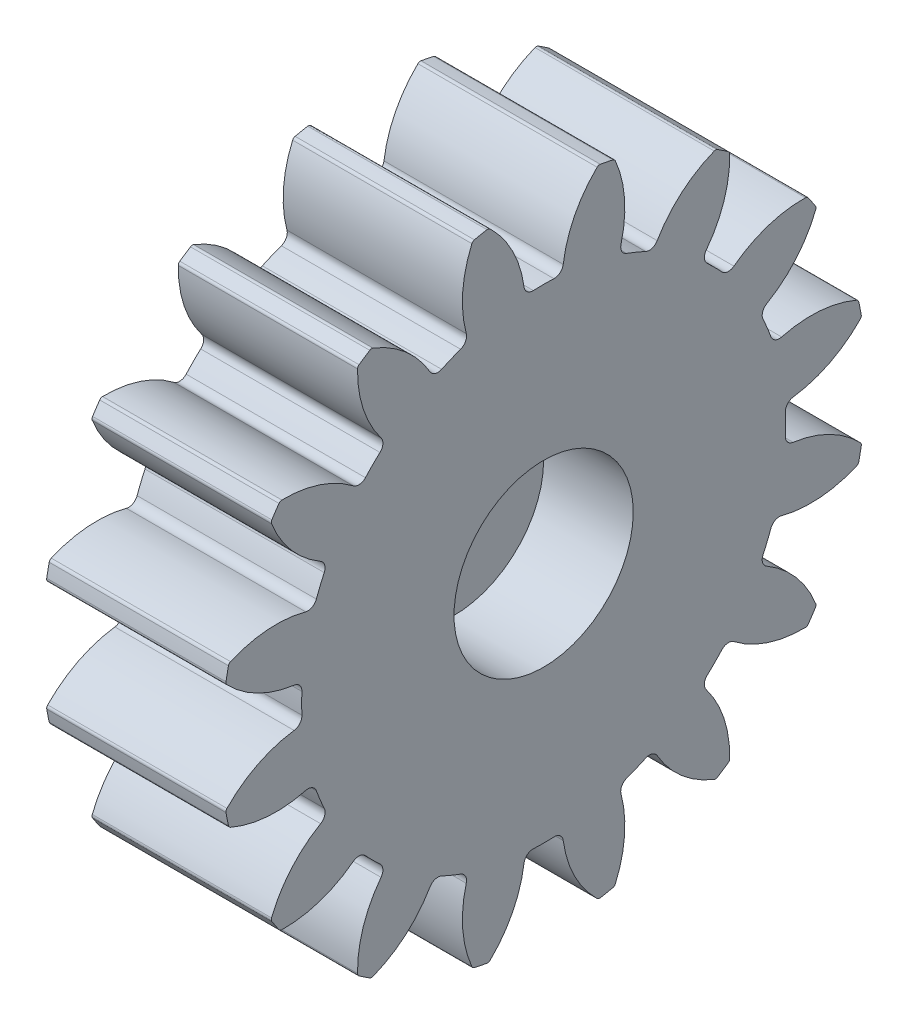
from build123d import *

# Parameters (mm, degrees)
BASPROSKE_W                = 5
BASPROSKE_H                = 9
TOOTHCUT_DEPTH             = 14.674794331
BREAKS_R                   = 0.1
ROOTFILLETS_R              = 0.251
TEETHCUTS_COUNT            = 16
TEETHCUTS_ANGLE            = 337.5
BREAKS_OF_TEETHCUTS_R      = 0.1
ROOTFILLETS_OF_TEETHCUTS_R = 0.251
BORSKE_R                   = 1
BORE_DEPTH                 = 50.0000508
SZKIC1_R                   = 2.5
WYTNIJ_WYCI_GNI_CIE1_DEPTH = 2.5
SZKIC2_R                   = 2
WYTNIJ_WYCI_GNI_CIE2_DEPTH = 1


with BuildPart() as part:
    # BasProSke → Base-Revolve (revolve)
    with BuildSketch(Plane(origin=(0, 0, 0), x_dir=(1, 0, 0), z_dir=(0, 1, 0)), mode=Mode.PRIVATE) as base_revolve_sk:
        with Locations((2.5, 4.5)):
            Rectangle(BASPROSKE_W, BASPROSKE_H)
    revolve(base_revolve_sk.sketch.rotate(Axis((-10, 0, 0), (1, 0, 0)), 180), axis=Axis((-10, 0, 0), (1, 0, 0)))

    # TooCutSke → ToothCut (cut, through all)
    with BuildSketch(Plane(origin=(0, 0, 0), x_dir=(0, 0, -1), z_dir=(1, 0, 0))):
        with BuildLine():
            ThreePointArc((0.523792937, 6.728643397), (0, 6.749), (-0.523792937, 6.728643397))
            ThreePointArc((-0.523792937, 6.728643397), (-0.828704482, 7.90962059), (-1.553355277, 8.890721711))
            ThreePointArc((-1.553355277, 8.890721711), (0, 9.0254), (1.553355277, 8.890721711))
            ThreePointArc((1.553355277, 8.890721711), (0.828704482, 7.90962059), (0.523792937, 6.728643397))
        make_face()
    toothcut = extrude(amount=TOOTHCUT_DEPTH, mode=Mode.SUBTRACT)

    # Breaks
    breaks_edges = [part.edges().sort_by_distance(p)[0] for p in [
        (2.5, 8.869006051, -1.529944991),
        (2.5, 8.869006051, 1.529944991),
    ]]
    fillet(breaks_edges, radius=BREAKS_R)

    # RootFillets
    rootfillets_edges = [part.edges().sort_by_distance(p)[0] for p in [
        (2.5, 6.728643397, -0.523792937),
        (2.5, 6.728643397, 0.523792937),
    ]]
    fillet(rootfillets_edges, radius=ROOTFILLETS_R)

    # TeethCuts: ToothCut ×16 about axis
    teethcuts_axis = Axis((-10, 0, 0), (1, 0, 0))
    for i in range(1, TEETHCUTS_COUNT):
        add(toothcut.rotate(teethcuts_axis, i * TEETHCUTS_ANGLE / (TEETHCUTS_COUNT - 1)), mode=Mode.SUBTRACT)

    # Breaks of TeethCuts
    breaks_of_teethcuts_edges = [part.edges().sort_by_distance(p)[0] for p in [
        (2.5, 8.779377764, 1.980536814),
        (2.5, 7.608408563, 4.80750654),
        (2.5, 7.353168799, 5.189499843),
        (2.5, 5.189499843, 7.353168799),
        (2.5, 4.80750654, 7.608408563),
        (2.5, 1.980536814, 8.779377764),
        (2.5, 1.529944991, 8.869006051),
        (2.5, -1.529944991, 8.869006051),
        (2.5, -1.980536814, 8.779377764),
        (2.5, -4.80750654, 7.608408563),
        (2.5, -5.189499843, 7.353168799),
        (2.5, -7.353168799, 5.189499843),
        (2.5, -7.608408563, 4.80750654),
        (2.5, -8.779377764, 1.980536814),
        (2.5, -8.869006051, 1.529944991),
        (2.5, -8.869006051, -1.529944991),
        (2.5, -8.779377764, -1.980536814),
        (2.5, -7.608408563, -4.80750654),
        (2.5, -7.353168799, -5.189499843),
        (2.5, -5.189499843, -7.353168799),
        (2.5, -4.80750654, -7.608408563),
        (2.5, -1.980536814, -8.779377764),
        (2.5, -1.529944991, -8.869006051),
        (2.5, 1.529944991, -8.869006051),
        (2.5, 1.980536814, -8.779377764),
        (2.5, 4.80750654, -7.608408563),
        (2.5, 5.189499843, -7.353168799),
        (2.5, 7.353168799, -5.189499843),
        (2.5, 7.608408563, -4.80750654),
        (2.5, 8.779377764, -1.980536814),
    ]]
    fillet(breaks_of_teethcuts_edges, radius=BREAKS_OF_TEETHCUTS_R)

    # RootFillets of TeethCuts
    rootfillets_of_teethcuts_edges = [part.edges().sort_by_distance(p)[0] for p in [
        (2.5, 6.416902795, 2.091018776),
        (2.5, 6.016009037, 3.058861924),
        (2.5, 5.128246912, 4.387491836),
        (2.5, 4.387491836, 5.128246912),
        (2.5, 3.058861924, 6.016009037),
        (2.5, 2.091018776, 6.416902795),
        (2.5, 0.523792937, 6.728643397),
        (2.5, -0.523792937, 6.728643397),
        (2.5, -2.091018776, 6.416902795),
        (2.5, -3.058861924, 6.016009037),
        (2.5, -4.387491836, 5.128246912),
        (2.5, -5.128246912, 4.387491836),
        (2.5, -6.016009037, 3.058861924),
        (2.5, -6.416902795, 2.091018776),
        (2.5, -6.728643397, 0.523792937),
        (2.5, -6.728643397, -0.523792937),
        (2.5, -6.416902795, -2.091018776),
        (2.5, -6.016009037, -3.058861924),
        (2.5, -5.128246912, -4.387491836),
        (2.5, -4.387491836, -5.128246912),
        (2.5, -3.058861924, -6.016009037),
        (2.5, -2.091018776, -6.416902795),
        (2.5, -0.523792937, -6.728643397),
        (2.5, 0.523792937, -6.728643397),
        (2.5, 2.091018776, -6.416902795),
        (2.5, 3.058861924, -6.016009037),
        (2.5, 4.387491836, -5.128246912),
        (2.5, 5.128246912, -4.387491836),
        (2.5, 6.016009037, -3.058861924),
        (2.5, 6.416902795, -2.091018776),
    ]]
    fillet(rootfillets_of_teethcuts_edges, radius=ROOTFILLETS_OF_TEETHCUTS_R)

    # BorSke → Bore (cut, symmetric)
    with BuildSketch(Plane(origin=(0, 0, 0), x_dir=(0, 0, -1), z_dir=(1, 0, 0))):
        with Locations(Location((0, 0, 0), (0, 0, 180))):
            Circle(BORSKE_R)
    extrude(amount=BORE_DEPTH, both=True, mode=Mode.SUBTRACT)

    # Szkic1 → Wytnij-wyciągnięcie1 (cut)
    with BuildSketch(Plane(origin=(5, 0, 0), x_dir=(0, 0, -1), z_dir=(1, 0, 0))):
        Circle(SZKIC1_R)
    extrude(amount=-WYTNIJ_WYCI_GNI_CIE1_DEPTH, mode=Mode.SUBTRACT)

    # Szkic2 → Wytnij-wyciągnięcie2 (cut)
    with BuildSketch(Plane.ZY):
        Circle(SZKIC2_R)
    extrude(amount=-WYTNIJ_WYCI_GNI_CIE2_DEPTH, mode=Mode.SUBTRACT)


solid = part.part
